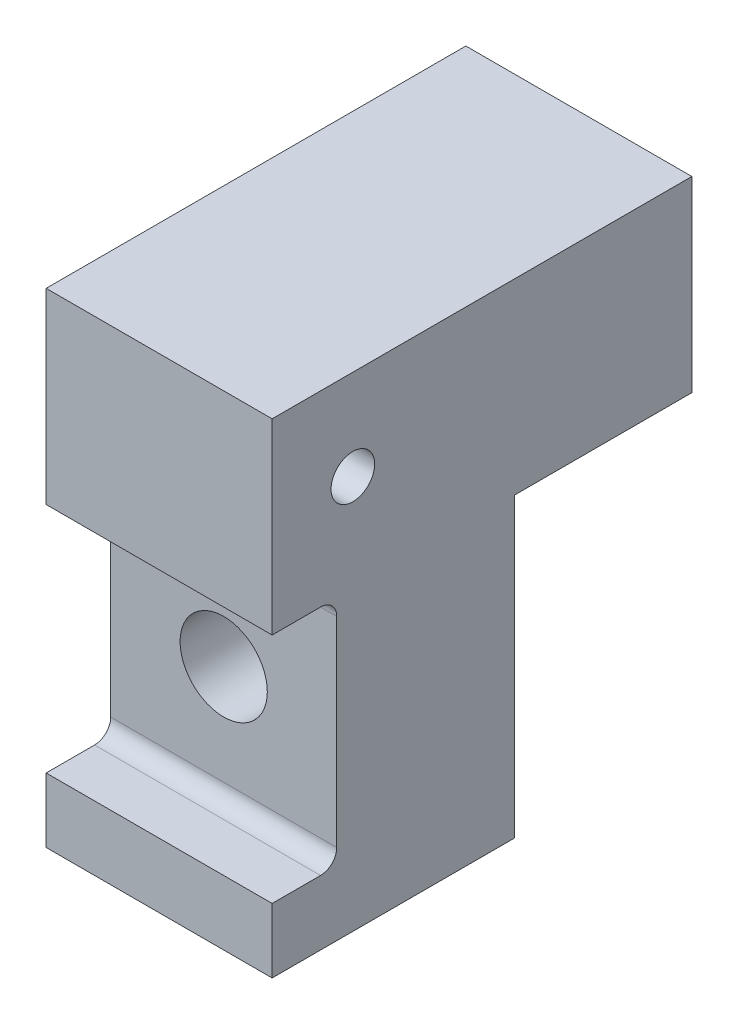
from build123d import *

# Parameters (mm, degrees)
SKETCH1_W           = 7
SKETCH1_H           = 13
BOSS_EXTRUDE1_DEPTH = 15
SKETCH9_W           = 2
SKETCH9_H           = 7.2
CUT_EXTRUDE6_DEPTH  = 18.783419244
SKETCH20_R          = 1.35
CUT_EXTRUDE13_DEPTH = 19.927493231
SKETCH21_R          = 2.4
CUT_EXTRUDE14_DEPTH = 8
FILLET1_R           = 0.5
SKETCH17_R          = 0.675
SKETCH19_R          = 0.9
CUT_EXTRUDE12_DEPTH = 4
SKETCH22_W          = 5.5
SKETCH22_H          = 9.2
CUT_EXTRUDE15_DEPTH = 18.78341932


with BuildPart() as part:
    # Sketch1 → Boss-Extrude1 (new body)
    with BuildSketch(Plane(origin=(0, 0, 0), x_dir=(1, 0, 0), z_dir=(0, 1, 0))):
        Rectangle(SKETCH1_W, SKETCH1_H)
    extrude(amount=BOSS_EXTRUDE1_DEPTH)

    # Sketch9 → Cut-Extrude6 (cut, through all)
    with BuildSketch(Plane.ZY.offset(3.5)):
        with Locations((5.5, 5.6)):
            Rectangle(SKETCH9_W, SKETCH9_H)
    extrude(amount=-CUT_EXTRUDE6_DEPTH, mode=Mode.SUBTRACT)

    # Sketch20 → Cut-Extrude13 (cut, through all)
    with BuildSketch(Plane.XY.offset(4.5)):
        with Locations((0, 5.6)):
            Circle(SKETCH20_R)
    extrude(amount=-CUT_EXTRUDE13_DEPTH, mode=Mode.SUBTRACT)

    # Sketch21 → Cut-Extrude14 (cut)
    with BuildSketch(Plane(origin=(0, 0, -6.5), x_dir=(-1, 0, 0), z_dir=(0, 0, -1))):
        with Locations((0, 5.6)):
            Circle(SKETCH21_R)
    extrude(amount=-CUT_EXTRUDE14_DEPTH, mode=Mode.SUBTRACT)

    # Fillet1
    fillet1_edges = [part.edges().sort_by_distance(p)[0] for p in [
        (0, 2, 4.5),
        (0, 9.2, 4.5),
    ]]
    fillet(fillet1_edges, radius=FILLET1_R)

    # Cut-Sweep1: sweep along a path in Sketch16
    with BuildLine(Plane(origin=(0, 12.2, 0), x_dir=(-1, 0, 0), z_dir=(0, -1, 0))) as cut_sweep1_path:
        Line((0, 6.5), (0, -2.5))
        ThreePointArc((0, -2.5), (-0.439339828, -3.560660172), (-1.5, -4))
        Line((-1.5, -4), (-3.5, -4))
    # Sketch17 → Cut-Sweep1 (sweep, cut)
    with BuildSketch(Plane(origin=(0, 0, -6.5), x_dir=(-1, 0, 0), z_dir=(0, 0, -1))):
        with Locations((0, 12.2)):
            Circle(SKETCH17_R)
    sweep(path=cut_sweep1_path.line, mode=Mode.SUBTRACT)

    # Sketch19 → Cut-Extrude12 (cut)
    with BuildSketch(Plane.ZY.offset(3.5)):
        with Locations((0.5, 12.2)):
            Circle(SKETCH19_R)
        with Locations((-3.5, 12.2)):
            Circle(SKETCH19_R)
    extrude(amount=-CUT_EXTRUDE12_DEPTH, mode=Mode.SUBTRACT)

    # Sketch22 → Cut-Extrude15 (cut, through all)
    with BuildSketch(Plane(origin=(3.5, 0, 0), x_dir=(0, 0, -1), z_dir=(1, 0, 0))):
        with Locations((3.75, 4.6)):
            Rectangle(SKETCH22_W, SKETCH22_H)
    extrude(amount=-CUT_EXTRUDE15_DEPTH, mode=Mode.SUBTRACT)


solid = part.part
